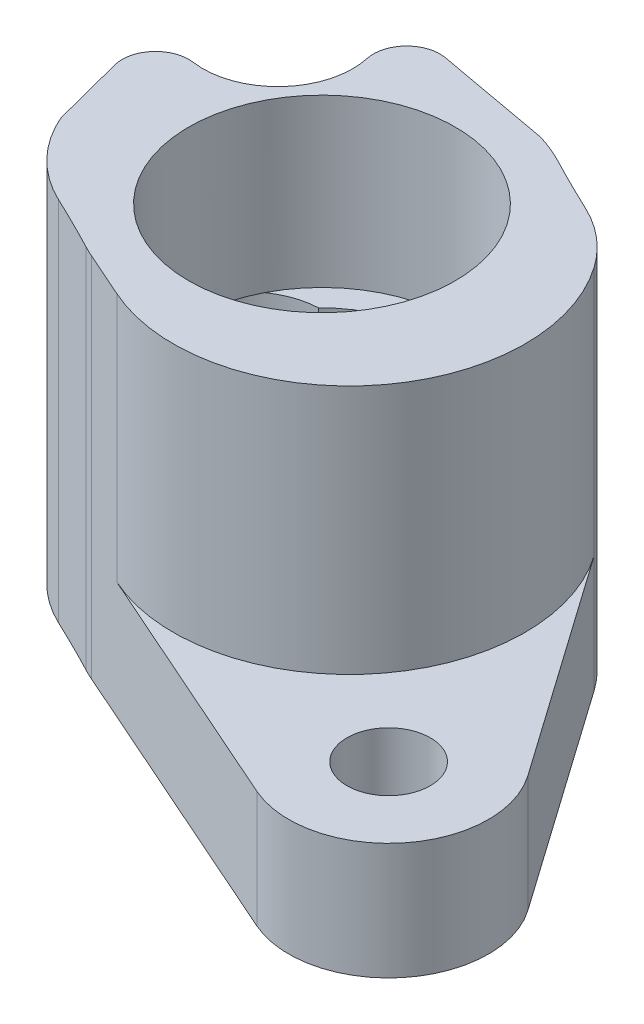
from build123d import *
from build123d.topology import SkipClean

# Parameters (mm, degrees)
SKETCH2_R           = 2.5
BOSS_EXTRUDE1_DEPTH = 7
FILLET1_R           = 90
BOSS_EXTRUDE3_DEPTH = 15
SKETCH4_R           = 8
CUT_EXTRUDE1_DEPTH  = 10
BOSS_EXTRUDE4_START = 10
BOSS_EXTRUDE4_DEPTH = 10


with BuildPart() as part:
    # Sketch2 → Boss-Extrude1 (new body)
    with BuildSketch(Plane(origin=(0, 0, 0), x_dir=(1, 0, 0), z_dir=(0, 1, 0))):
        with BuildLine():
            Line((-4.24846021, -9.602113613), (13.572308451, -17.486922065))
            ThreePointArc((13.572308451, -17.486922065), (20.638500285, -15.805826469), (20.907079545, -8.547382103))
            Line((20.907079545, -8.547382103), (11.451696022, 4.891208687))
            ThreePointArc((11.451696022, 4.891208687), (9.270724445, 7.034926316), (6.472222222, 8.268031175))
            ThreePointArc((6.472222222, 8.268031175), (4.86754966, 9.30359932), (3.101845071, 10.031378627))
            Line((3.101845071, 10.031378627), (-8.821699821, 13.718308443))
            ThreePointArc((-8.821699821, 13.718308443), (-15.091857172, 11.987583677), (-16.147811194, 5.569231667))
            Line((-16.147811194, 5.569231667), (-12.308520784, -3.358124948))
            ThreePointArc((-12.308520784, -3.358124948), (-9.971976629, -6.504419403), (-6.472222222, -8.268031175))
            ThreePointArc((-6.472222222, -8.268031175), (-5.401685102, -9.003987898), (-4.24846021, -9.602113613))
        make_face()
        with Locations(Location((16, -12, 0), (0, 0, 270))):
            Circle(SKETCH2_R, mode=Mode.SUBTRACT)
        with Locations(Location((-10.604337088, 7.953252816, 0), (0, 0, 270))):
            Circle(SKETCH2_R, mode=Mode.SUBTRACT)
        with BuildLine():
            ThreePointArc((-4.694444444, -4.495797077), (0, -6.5), (4.694444444, -4.495797077))
            ThreePointArc((4.694444444, -4.495797077), (9, 0), (4.694444444, 4.495797077))
            ThreePointArc((4.694444444, 4.495797077), (0, 6.5), (-4.694444444, 4.495797077))
            ThreePointArc((-4.694444444, 4.495797077), (-9, 0), (-4.694444444, -4.495797077))
        make_face(mode=Mode.SUBTRACT)
    extrude(amount=BOSS_EXTRUDE1_DEPTH)

    # Fillet1
    fillet1_edges = [part.edges().sort_by_distance(p)[0] for p in [
        (6.472222222, 3.5, -8.268031175),
        (-6.472222222, 3.5, 8.268031175),
    ]]
    fillet(fillet1_edges, radius=FILLET1_R)

    # Sketch3 → Boss-Extrude3 (add)
    with BuildSketch(Plane(origin=(0, 7, 0), x_dir=(1, 0, 0), z_dir=(0, 1, 0))):
        with BuildLine():
            Line((-13.446880098, 1.012795393), (-12.308520784, -3.358124948))
            ThreePointArc((-12.308520784, -3.358124948), (-10.611843956, -5.907229762), (-8.121968415, -7.689690813))
            ThreePointArc((-8.121968415, -7.689690813), (-6.480430757, -8.483296944), (-4.855306799, -9.309994408))
            ThreePointArc((-4.855306799, -9.309994408), (-4.554226262, -9.460920841), (-4.24846021, -9.602113613))
            Line((-4.24846021, -9.602113613), (-1.454246479, -10.838414946))
            ThreePointArc((-1.454246479, -10.838414946), (10.979115699, -7.880432641), (11.451696022, 4.891208687))
            ThreePointArc((11.451696022, 4.891208687), (9.968863726, 6.507036925), (8.121968415, 7.689690813))
            ThreePointArc((8.121968415, 7.689690813), (6.480430757, 8.483296944), (4.855306799, 9.309994408))
            ThreePointArc((4.855306799, 9.309994408), (3.994892398, 9.710346787), (3.101845071, 10.031378627))
            Line((3.101845071, 10.031378627), (-3.895223267, 11.305534387))
            ThreePointArc((-3.895223267, 11.305534387), (-5.691953988, 10.727471116), (-6.207623157, 8.911848981))
            ThreePointArc((-6.207623157, 8.911848981), (-7.30582589, 4.892236012), (-11.232333003, 3.497288147))
            ThreePointArc((-11.232333003, 3.497288147), (-13.004436636, 2.847636589), (-13.446880098, 1.012795393))
        make_face()
        with BuildLine():
            ThreePointArc((4.694444444, -4.495797077), (9, 0), (4.694444444, 4.495797077))
            ThreePointArc((4.694444444, 4.495797077), (0, 6.5), (-4.694444444, 4.495797077))
            ThreePointArc((-4.694444444, 4.495797077), (-9, 0), (-4.694444444, -4.495797077))
            ThreePointArc((-4.694444444, -4.495797077), (0, -6.5), (4.694444444, -4.495797077))
        make_face(mode=Mode.SUBTRACT)
    extrude(amount=BOSS_EXTRUDE3_DEPTH)

    # Sketch4 → Cut-Extrude1 (cut)
    with BuildSketch(Plane(origin=(0, 22, 0), x_dir=(1, 0, 0), z_dir=(0, 1, 0))):
        Circle(SKETCH4_R)
    extrude(amount=-CUT_EXTRUDE1_DEPTH, mode=Mode.SUBTRACT)

    # Sketch5 → Boss-Extrude4 (add)
    with SkipClean():  # the faces are left unmerged after this step: merging them gives an invalid solid
        with BuildSketch(Plane(origin=(0, 12, 0), x_dir=(1, 0, 0), z_dir=(0, 1, 0)).offset(BOSS_EXTRUDE4_START)):
            with BuildLine():
                ThreePointArc((-7.111111111, 3.664982778), (-8, 0), (-7.111111111, -3.664982778))
                ThreePointArc((-7.111111111, -3.664982778), (-9, 0), (-7.111111111, 3.664982778))
            make_face()
            with BuildLine():
                ThreePointArc((7.111111111, -3.664982778), (9, 0), (7.111111111, 3.664982778))
                ThreePointArc((7.111111111, 3.664982778), (8, 0), (7.111111111, -3.664982778))
            make_face()
        extrude(amount=-BOSS_EXTRUDE4_DEPTH)


solid = part.part
